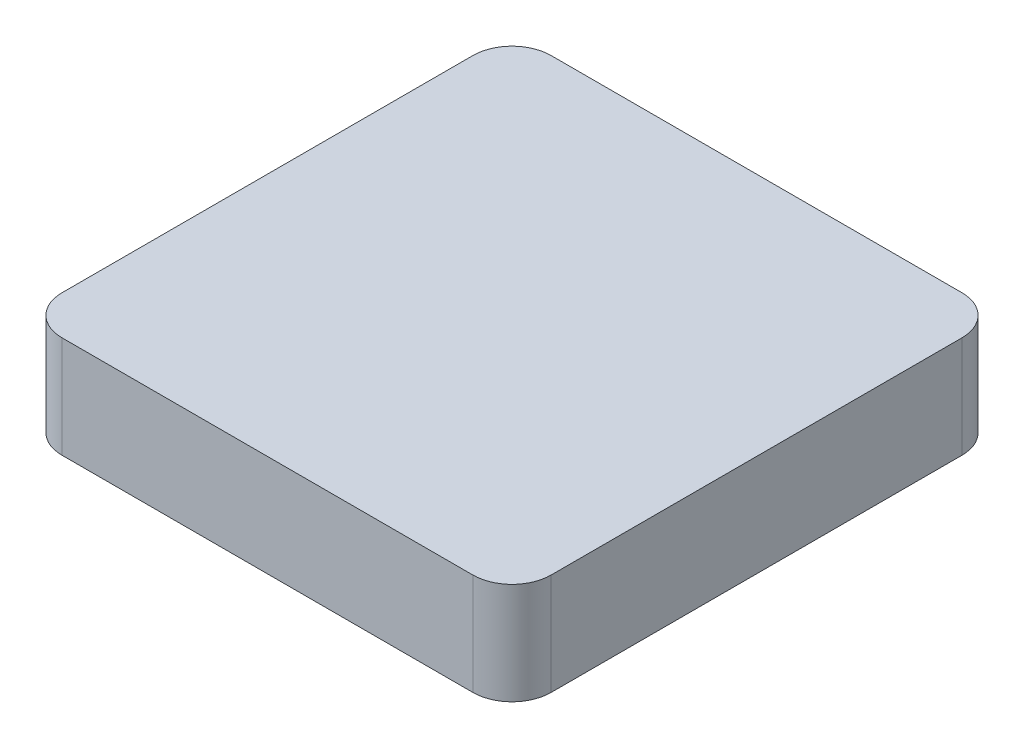
from build123d import *

# Parameters (mm, degrees)
SKETCH2_W           = 25
SKETCH2_H           = 25
BOSS_EXTRUDE1_DEPTH = 5.2
FILLET1_R           = 2


with BuildPart() as part:
    # Sketch2 → Boss-Extrude1 (new body)
    with BuildSketch(Plane(origin=(0, 0, 0), x_dir=(1, 0, 0), z_dir=(0, 1, 0))):
        Rectangle(SKETCH2_W, SKETCH2_H)
    extrude(amount=BOSS_EXTRUDE1_DEPTH)

    # Fillet1
    fillet1_edges = [part.edges().sort_by_distance(p)[0] for p in [
        (12.5, 2.6, 12.5),
        (-12.5, 2.6, 12.5),
        (-12.5, 2.6, -12.5),
        (12.5, 2.6, -12.5),
    ]]
    fillet(fillet1_edges, radius=FILLET1_R)


solid = part.part
